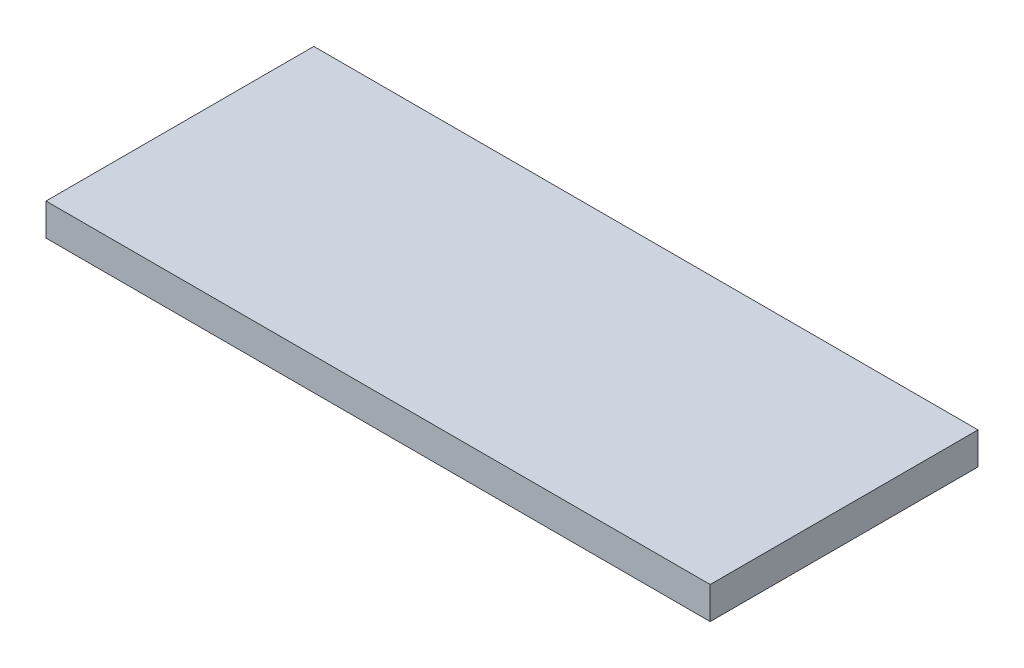
from build123d import *

# Parameters (mm, degrees)
ESQUISSE1_W        = 62
ESQUISSE1_H        = 25
BOSS_EXTRU_1_DEPTH = 3


with BuildPart() as part:
    # Esquisse1 → Boss.-Extru.1 (new body)
    with BuildSketch(Plane(origin=(0, 0, 0), x_dir=(1, 0, 0), z_dir=(0, 1, 0))):
        Rectangle(ESQUISSE1_W, ESQUISSE1_H)
    extrude(amount=BOSS_EXTRU_1_DEPTH)


solid = part.part
